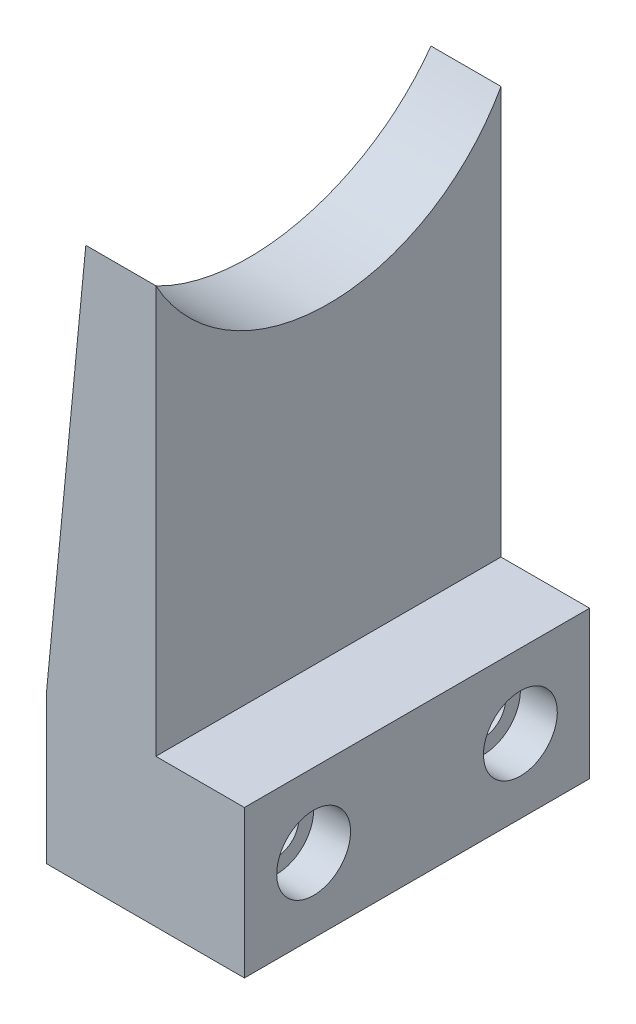
from build123d import *

# Parameters (mm, degrees)
GRIPPER_ATTACHMENT_BASE_SKETCH_W = 11.1125
GRIPPER_ATTACHMENT_BASE_SKETCH_H = 15
GRIPPER_ATTACHMENT_BASE_DEPTH    = 35.0588586
THROUGH_HOLES_SKETCH_R           = 2.25
SCREW_THROUGH_HOLES_DEPTH        = 38.534800154
SOCKET_RECESSES_SKETCH_R         = 3.75
SOCKET_RECESSES_DEPTH            = 3.75
FINGER_CAVITY_SKETCH_W           = 2.5294293
FINGER_CAVITY_SKETCH_H           = 15
FINGER_CAVITY_DEPTH              = 9
THICKENER_BASE_DEPTH             = 11.1125
THICKNESS_CUTOFF_SKETCH_W        = 61.996732773
THICKNESS_CUTOFF_SKETCH_H        = 64.835459205
THICKNESS_CUTOFF_DEPTH           = 63.508667222


with BuildPart() as part:
    # Gripper Attachment Base Sketch → Gripper Attachment Base (new body)
    with BuildSketch(Plane.XY):
        Rectangle(GRIPPER_ATTACHMENT_BASE_SKETCH_W, GRIPPER_ATTACHMENT_BASE_SKETCH_H)
    extrude(amount=GRIPPER_ATTACHMENT_BASE_DEPTH)

    # Through-Holes Sketch → Screw Through-Holes (cut, through all)
    with BuildSketch(Plane(origin=(5.55625, 0, 0), x_dir=(0, 0, -1), z_dir=(1, 0, 0))):
        with Locations(Location((-28.0294293, 0, 0), (0, 0, 90))):
            Circle(THROUGH_HOLES_SKETCH_R)
        with Locations(Location((-7.0294293, 0, 0), (0, 0, 90))):
            Circle(THROUGH_HOLES_SKETCH_R)
    extrude(amount=-SCREW_THROUGH_HOLES_DEPTH, mode=Mode.SUBTRACT)

    # Socket Recesses Sketch → Socket Recesses (cut)
    with BuildSketch(Plane(origin=(5.55625, 0, 0), x_dir=(0, 0, -1), z_dir=(1, 0, 0))):
        with Locations(Location((-28.0294293, 0, 0), (0, 0, 90))):
            Circle(SOCKET_RECESSES_SKETCH_R)
        with Locations(Location((-7.0294293, 0, 0), (0, 0, 90))):
            Circle(SOCKET_RECESSES_SKETCH_R)
    extrude(amount=-SOCKET_RECESSES_DEPTH, mode=Mode.SUBTRACT)

    # Finger Cavity Sketch → Finger Cavity (add)
    with BuildSketch(Plane.ZY.offset(5.55625)):
        with Locations((1.26471465, 0)):
            Rectangle(FINGER_CAVITY_SKETCH_W, FINGER_CAVITY_SKETCH_H)
        with Locations((33.79414395, 0)):
            Rectangle(FINGER_CAVITY_SKETCH_W, FINGER_CAVITY_SKETCH_H)
    extrude(amount=FINGER_CAVITY_DEPTH)

    # Thickener Base Sketch → Thickener Base (add)
    with BuildSketch(Plane(origin=(-3.44375, 0, 0), x_dir=(0, 0, -1), z_dir=(1, 0, 0))):
        with BuildLine():
            Line((0, 7.5), (-35.0588586, 7.5))
            Line((-35.0588586, 7.5), (-35.0588586, 48.89593))
            ThreePointArc((-35.0588586, 48.89593), (-17.5294293, 38.525006197), (0, 48.89593))
            Line((0, 48.89593), (0, 7.5))
        make_face()
    extrude(amount=-THICKENER_BASE_DEPTH)

    # Thickness Cutoff Sketch → Thickness Cutoff (cut, through all)
    with BuildSketch(Plane(origin=(-15.139601336, 1.462907231, 0), x_dir=(0, 0, -1), z_dir=(0.9953639682653084, -0.09617988708216554, 0))):
        with Locations((-17.347442804, 24.375229456)):
            Rectangle(THICKNESS_CUTOFF_SKETCH_W, THICKNESS_CUTOFF_SKETCH_H)
    extrude(amount=-THICKNESS_CUTOFF_DEPTH, mode=Mode.SUBTRACT)


solid = part.part
